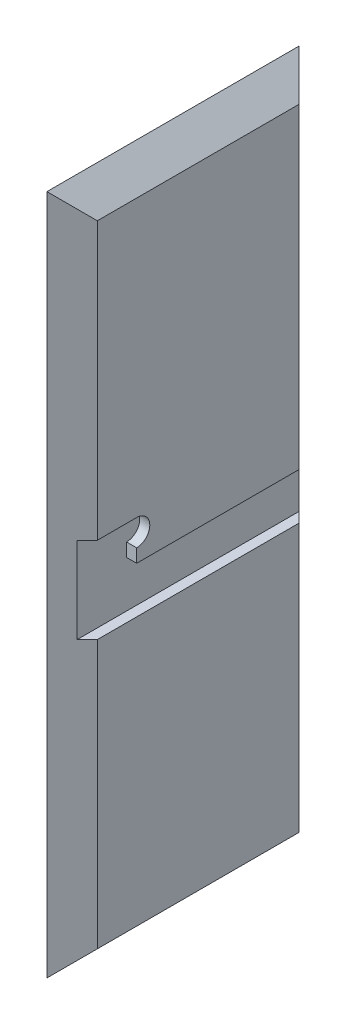
from build123d import *

# Parameters (mm, degrees)
SKETCH1_W               = 127
SKETCH1_H               = 342.9
BOSS_EXTRUDE1_DEPTH     = 12.7
DRAFT1_ANGLE            = -45
CUT_EXTRUDE1_DEPTH      = 184.272045059
CUT_EXTRUDE1_DEPTH_BACK = 5.08


with BuildPart() as part:
    # Sketch1 → Boss-Extrude1 (new body)
    with BuildSketch(Plane(origin=(0, 0, 0), x_dir=(0, 0, -1), z_dir=(1, 0, 0))):
        Rectangle(SKETCH1_W, SKETCH1_H)
    extrude(amount=BOSS_EXTRUDE1_DEPTH)

    # Draft1
    draft1_faces = [part.faces().sort_by_distance(p)[0] for p in [
        (6.35, -171.45, 0),
        (6.35, 0, -63.5),
        (6.35, 0, 63.5),
        (6.35, 171.45, 0),
    ]]
    draft(draft1_faces, Plane(origin=(0, 0, 0), x_dir=(0, 0, -1), z_dir=(-1, 0, 0)), DRAFT1_ANGLE)

    # Sketch2 → Cut-Extrude1 (cut, two sides: drawn at the far end of the back side and taken through both)
    with BuildSketch(Plane(origin=(12.7, 0, 0), x_dir=(0, 0, -1), z_dir=(1, 0, 0)).offset(-CUT_EXTRUDE1_DEPTH_BACK)):
        with BuildLine():
            Line((-63.5, 19.431), (-30.988, 19.431))
            ThreePointArc((-30.988, 19.431), (-24.384, 12.827), (-30.988, 6.223))
            Line((-30.988, 6.223), (-30.988, -0.508))
            Line((-30.988, -0.508), (63.5, -0.508))
            Line((63.5, -0.508), (63.5, -23.876))
            Line((63.5, -23.876), (-63.5, -23.876))
            Line((-63.5, -23.876), (-63.5, 19.431))
        make_face()
    extrude(amount=CUT_EXTRUDE1_DEPTH + CUT_EXTRUDE1_DEPTH_BACK, mode=Mode.SUBTRACT)


solid = part.part
